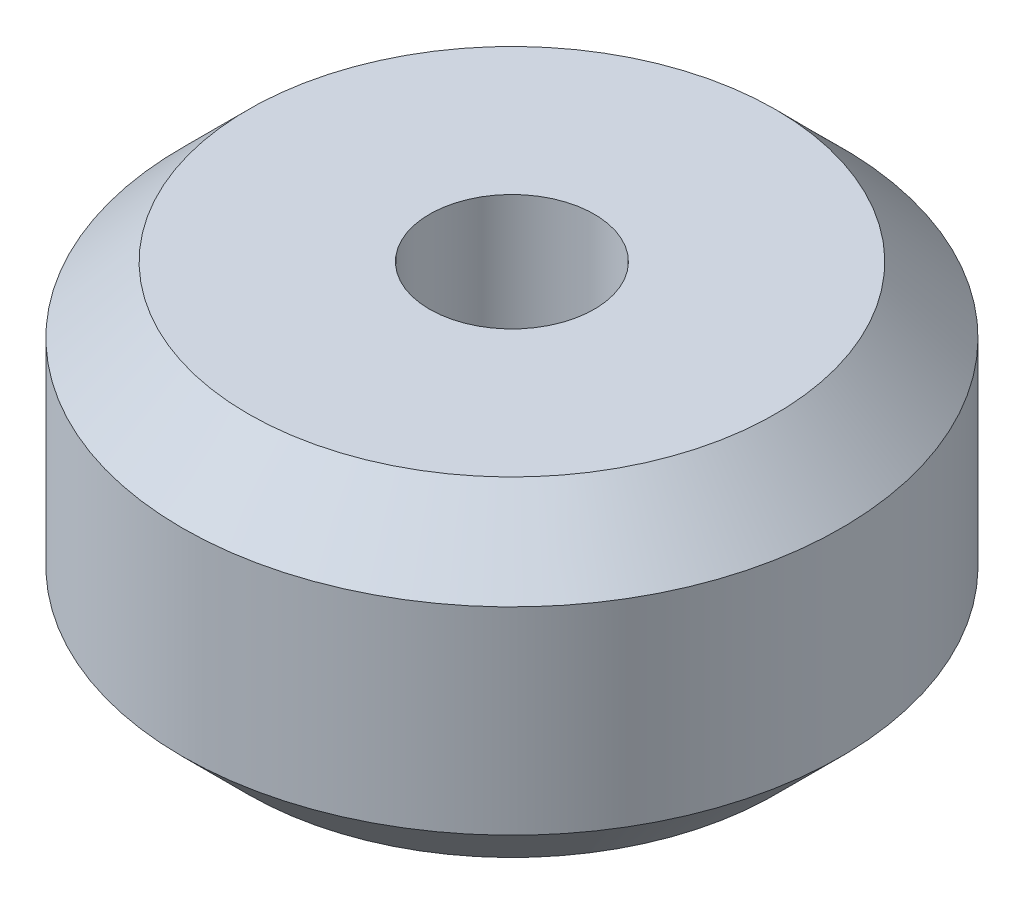
from build123d import *


with BuildPart() as part:
    # Sketch1 → Revolve1 (revolve)
    with BuildSketch(Plane.XY, mode=Mode.PRIVATE) as revolve1_sk:
        Polygon((-8, -5), (-2.5, -5), (-2.5, 5), (-8, 5), (-10, 3), (-10, -3), align=None)
    revolve(revolve1_sk.sketch.rotate(Axis((0, 23.892278862, 0), (0, -1, 0)), 270), axis=Axis((0, 23.892278862, 0), (0, -1, 0)))


solid = part.part
